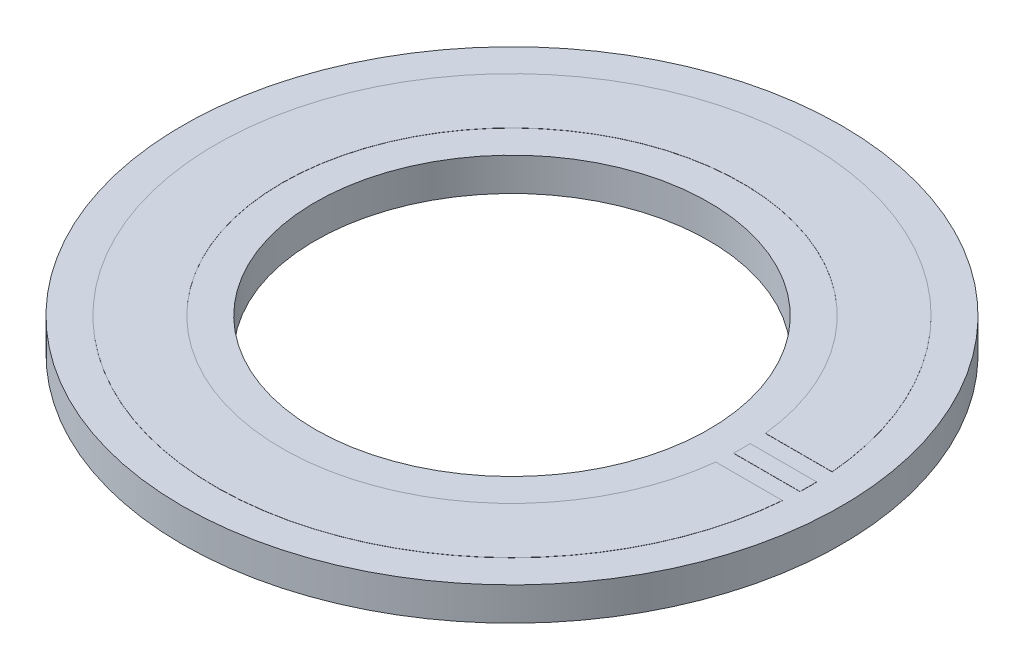
from build123d import *

# Parameters (mm, degrees)
SKETCH_1_R      = 19.858230866
SKETCH_1_R_2    = 11.858230866
EXTRUDE_1_DEPTH = 2
EXTRUDE_3_DEPTH = 0.01


with BuildPart() as part:
    # Эскиз1 → Бобышка-Вытянуть1 (new body)
    with BuildSketch(Plane(origin=(0, 26.1, 0), x_dir=(1, 0, 0), z_dir=(0, 1, 0))):
        with Locations(Location((0, 0, 0), (0, 0, 270))):
            Circle(SKETCH_1_R)
        with Locations(Location((0, 0, 0), (0, 0, 270))):
            Circle(SKETCH_1_R_2, mode=Mode.SUBTRACT)
    extrude(amount=EXTRUDE_1_DEPTH)

    # Эскиз3 → Бобышка-Вытянуть3 (add)
    with BuildSketch(Plane(origin=(0, 28.1, 0), x_dir=(1, 0, 0), z_dir=(0, 1, 0))):
        with BuildLine():
            Line((17.85122992, -0.5), (13.849208019, -0.5))
            ThreePointArc((13.849208019, -0.5), (13.858230866, 0), (13.849208019, 0.5))
            Line((13.849208019, 0.5), (17.85122992, 0.5))
            ThreePointArc((17.85122992, 0.5), (17.858230866, 0), (17.85122992, -0.5))
        make_face()
        with BuildLine():
            Line((17.795123199, -1.5), (13.776812503, -1.5))
            ThreePointArc((13.776812503, -1.5), (-13.858230866, 0), (13.776812503, 1.5))
            Line((13.776812503, 1.5), (17.795123199, 1.5))
            ThreePointArc((17.795123199, 1.5), (-17.858230866, 0), (17.795123199, -1.5))
        make_face()
    extrude(amount=EXTRUDE_3_DEPTH)


solid = part.part
